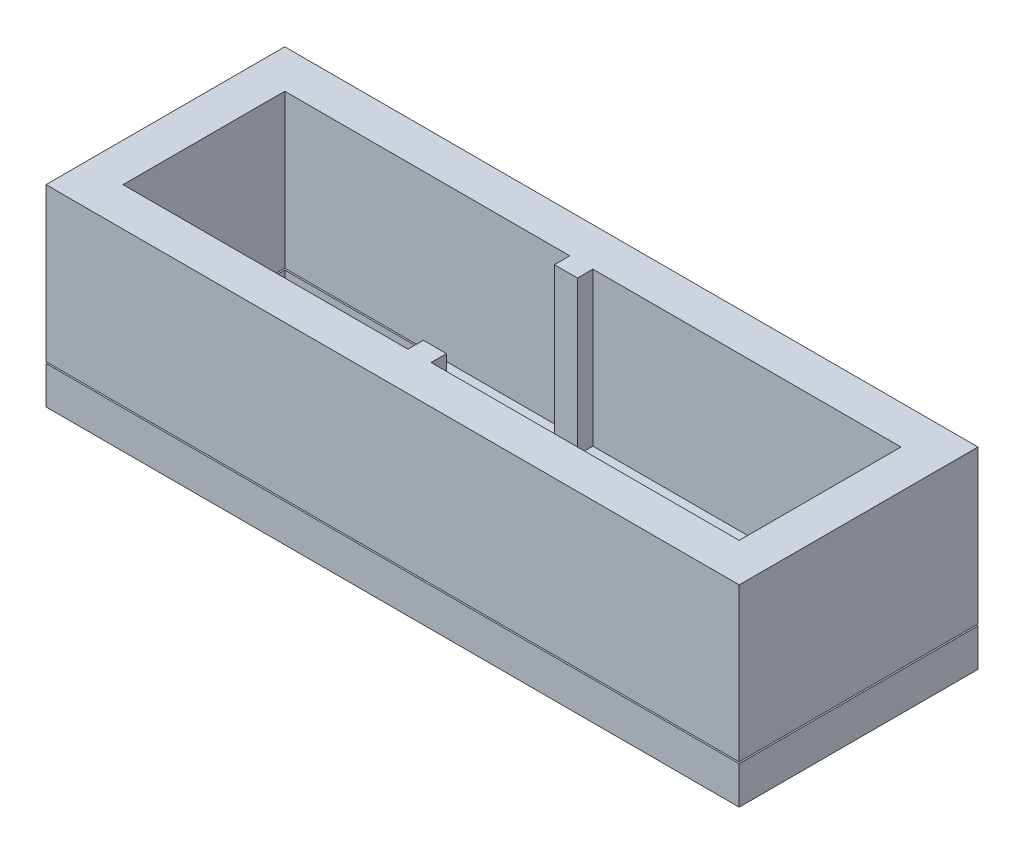
from build123d import *

# Parameters (mm, degrees)
SKETCH1_W                    = 114.3
SKETCH1_H                    = 39.37
SKETCH1_W_2                  = 101.6
SKETCH1_H_2                  = 26.67
BOSS_EXTRUDE1_DEPTH          = 25.4
SKETCH3_W                    = 114.3
SKETCH3_H                    = 39.37
BOSS_EXTRUDE2_DEPTH          = 6.35
SKETCH4_W                    = 3.81
SKETCH4_H                    = 2.54
BOSS_EXTRUDE3_DEPTH          = 25.4
SKETCH8_W                    = 26.67
SKETCH8_H                    = 26.67
CUT_EXTRUDE2_DEPTH           = 19.05
CUT_EXTRUDE_THIN1_DEPTH      = 74.900469552
CUT_EXTRUDE_THIN1_DEPTH_BACK = 74.900469552


with BuildPart() as part:
    # Sketch1 → Boss-Extrude1 (new body)
    with BuildSketch(Plane(origin=(0, 0, 0), x_dir=(1, 0, 0), z_dir=(0, 1, 0))):
        Rectangle(SKETCH1_W, SKETCH1_H)
        Rectangle(SKETCH1_W_2, SKETCH1_H_2, mode=Mode.SUBTRACT)
    extrude(amount=BOSS_EXTRUDE1_DEPTH)

    # Sketch3 → Boss-Extrude2 (add)
    with BuildSketch(Plane.XZ):
        Rectangle(SKETCH3_W, SKETCH3_H)
    extrude(amount=BOSS_EXTRUDE2_DEPTH)

    # Sketch4 → Boss-Extrude3 (add)
    with BuildSketch(Plane(origin=(0, 0, 0), x_dir=(1, 0, 0), z_dir=(0, 1, 0))):
        with Locations((-1.905, -12.065)):
            Rectangle(SKETCH4_W, SKETCH4_H)
        with Locations((-1.905, 12.065)):
            Rectangle(SKETCH4_W, SKETCH4_H)
    extrude(amount=BOSS_EXTRUDE3_DEPTH)

    # Sketch8 → Cut-Extrude2 (cut)
    with BuildSketch(Plane(origin=(0, 0, 0), x_dir=(1, 0, 0), z_dir=(0, 1, 0))):
        with Locations((-37.465, 0)):
            Rectangle(SKETCH8_W, SKETCH8_H)
    extrude(amount=-CUT_EXTRUDE2_DEPTH, mode=Mode.SUBTRACT)

    # Sketch7 → Cut-Extrude-Thin1 (cut, two sides: drawn at the far end of the back side and taken through both)
    with BuildSketch(Plane.XY.offset(19.685).offset(-CUT_EXTRUDE_THIN1_DEPTH_BACK)):
        Polygon((-57.15, -0.127), (0, -0.127), (57.15, -0.127), (57.15, 0.127), (0, 0.127), (-57.15, 0.127), align=None)
    extrude(amount=CUT_EXTRUDE_THIN1_DEPTH + CUT_EXTRUDE_THIN1_DEPTH_BACK, mode=Mode.SUBTRACT)


with BuildPart() as cut_extrude_thin1_piece_1:
    # of the separate pieces the step leaves, piece 1, a body of its own (cut_extrude_thin1_pieces)
    add(part.part.solids().sort_by_distance((-57.15, 25.4, 19.685))[0])


with BuildPart() as cut_extrude_thin1_piece_2:
    # of the separate pieces the step leaves, piece 2, a body of its own (cut_extrude_thin1_pieces)
    add(part.part.solids().sort_by_distance((-57.15, -0.127, 19.685))[0])


solid = Compound([cut_extrude_thin1_piece_1.part, cut_extrude_thin1_piece_2.part])
